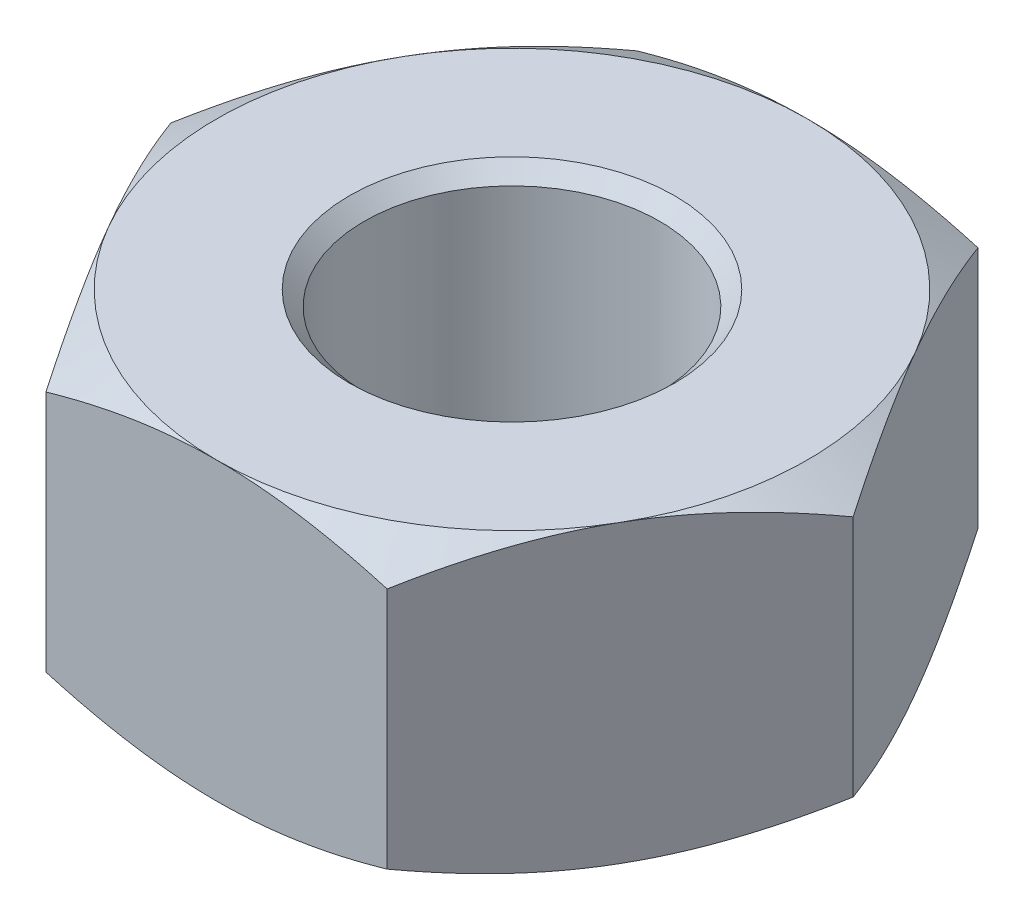
from build123d import *

# Parameters (mm, degrees)
SKETCH2_R           = 0.75
BOSS_EXTRUDE1_DEPTH = 1.5
SKETCH3_OUTSIDE_W   = 17.686
SKETCH3_OUTSIDE_H   = 17.222
SKETCH3_OUTSIDE_R   = 1.5
CUT_EXTRUDE1_DEPTH  = 3.25
CUT_EXTRUDE1_DRAFT  = 60
SKETCH4_OUTSIDE_W   = 17.686
SKETCH4_OUTSIDE_H   = 17.222
SKETCH4_OUTSIDE_R   = 1.5
CUT_EXTRUDE2_DEPTH  = 3.25
CUT_EXTRUDE2_DRAFT  = -60
CHAMFER1_SIZE       = 0.075


with BuildPart() as part:
    # Sketch2 → Boss-Extrude1 (new body)
    with BuildSketch(Plane(origin=(0, 0, 0), x_dir=(1, 0, 0), z_dir=(0, 1, 0))):
        Polygon((1.732050808, 0), (0.866025404, 1.5), (-0.866025404, 1.5), (-1.732050808, 0), (-0.866025404, -1.5), (0.866025404, -1.5), align=None)
        with Locations(Location((0, 0, 0), (0, 0, 270))):
            Circle(SKETCH2_R, mode=Mode.SUBTRACT)
    extrude(amount=BOSS_EXTRUDE1_DEPTH)


with BuildPart() as cut_extrude1_tool:
    # Sketch3 outside → Cut-Extrude1 (with draft: the straight prism first)
    with BuildSketch(Plane(origin=(0, 0, 0), x_dir=(1, 0, 0), z_dir=(0, 1, 0))):
        Rectangle(SKETCH3_OUTSIDE_W, SKETCH3_OUTSIDE_H)
        Circle(SKETCH3_OUTSIDE_R, mode=Mode.SUBTRACT)
    extrude(amount=CUT_EXTRUDE1_DEPTH)
    # Cut-Extrude1: the draft: its side faces are tilted about the plane it starts from
    cut_extrude1_sides = [cut_extrude1_tool.faces().sort_by_distance(p)[0] for p in [
        (0, 1.625, 8.611),
        (8.843, 1.625, 0),
        (0, 1.625, -8.611),
        (-8.843, 1.625, 0),
        (-1.5, 1.625, 0),
    ]]
    draft(cut_extrude1_sides, Plane(origin=(0, 0, 0), x_dir=(1, 0, 0), z_dir=(0, 1, 0)), CUT_EXTRUDE1_DRAFT)


with BuildPart() as part_1:
    add(part.part)

    # Cut-Extrude1: cut by cut_extrude1_tool
    add(cut_extrude1_tool.part, mode=Mode.SUBTRACT)


with BuildPart() as cut_extrude2_tool:
    # Sketch4 outside → Cut-Extrude2 (with draft: the straight prism first)
    with BuildSketch(Plane(origin=(0, 1.5, 0), x_dir=(1, 0, 0), z_dir=(0, 1, 0))):
        Rectangle(SKETCH4_OUTSIDE_W, SKETCH4_OUTSIDE_H)
        Circle(SKETCH4_OUTSIDE_R, mode=Mode.SUBTRACT)
    extrude(amount=-CUT_EXTRUDE2_DEPTH)
    # Cut-Extrude2: the draft: its side faces are tilted about the plane it starts from
    cut_extrude2_sides = [cut_extrude2_tool.faces().sort_by_distance(p)[0] for p in [
        (0, -0.125, 8.611),
        (8.843, -0.125, 0),
        (0, -0.125, -8.611),
        (-8.843, -0.125, 0),
        (-1.5, -0.125, 0),
    ]]
    draft(cut_extrude2_sides, Plane(origin=(0, 1.5, 0), x_dir=(1, 0, 0), z_dir=(0, 1, 0)), CUT_EXTRUDE2_DRAFT)


with BuildPart() as part_2:
    add(part_1.part)

    # Cut-Extrude2: cut by cut_extrude2_tool
    add(cut_extrude2_tool.part, mode=Mode.SUBTRACT)

    # Chamfer1
    chamfer1_edges = [part_2.edges().sort_by_distance(p)[0] for p in [
        (0, 0, -0.75),
        (0, 1.5, -0.75),
    ]]
    chamfer(chamfer1_edges, length=CHAMFER1_SIZE)


solid = part_2.part
